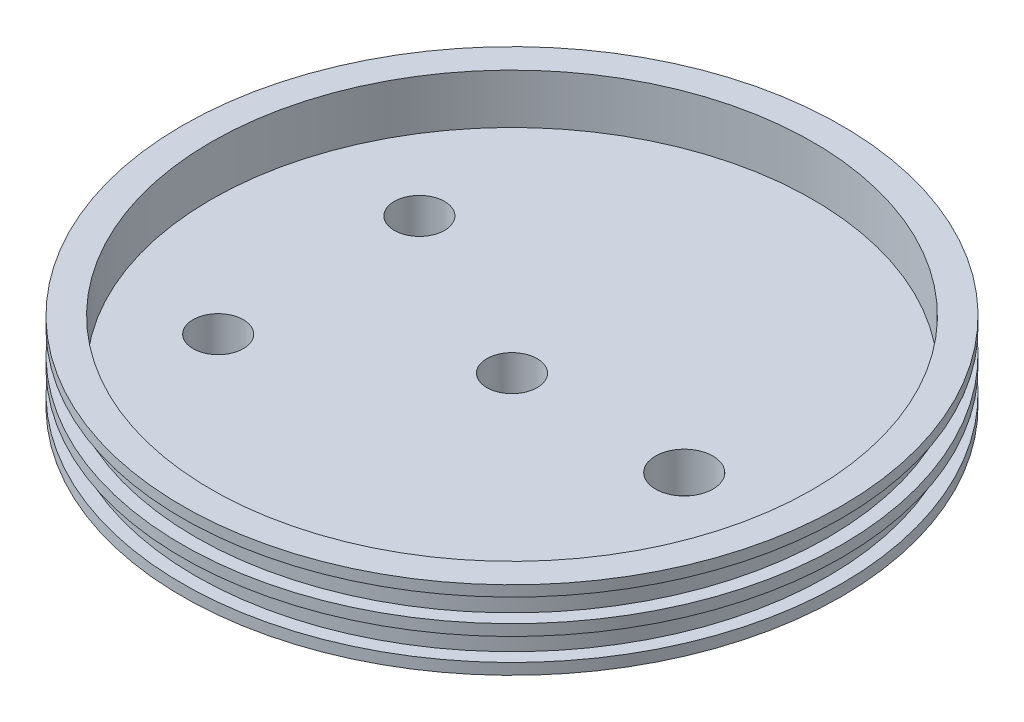
from build123d import *

# Parameters (mm, degrees)
SKETCH6_R                                = 66.04
BOSS_EXTRUDE1_DEPTH                      = 2.54
PIPE_TAP_DRILL_FOR_1_4_TAP_GN2_D         = 11.1252
SKETCH7_R                                = 6.35
CUT_EXTRUDE1_SIPHON_DEPTH                = 105.994177492
PIPE_TAP_DRILL_FOR_1_4_TAP_RELIEF_VALV_D = 11.1252
PIPE_TAP_DRILL_FOR_1_4_TAP_VENT_VALVE_D  = 11.1252


with BuildPart() as part:
    # Sketch1 → Revolve1 (revolve)
    with BuildSketch(Plane.XY, mode=Mode.PRIVATE) as revolve1_sk:
        Polygon((0, 0), (72.898, 0), (72.898, 2.4638), (69.977, 2.4638), (69.977, 7.4422), (72.898, 7.4422), (72.898, 9.906), (69.977, 9.906), (69.977, 14.986), (72.898, 14.986), (72.898, 17.3482), (66.548, 17.3482), (66.548, 6.35), (0, 6.35), align=None)
    revolve(revolve1_sk.sketch.rotate(Axis((0, 48.192213231, 0), (0, -1, 0)), 180), axis=Axis((0, 48.192213231, 0), (0, -1, 0)))

    # Sketch6 → Boss-Extrude1 (add)
    with BuildSketch(Plane.XZ):
        Circle(SKETCH6_R)
    extrude(amount=BOSS_EXTRUDE1_DEPTH)

    # Pipe Tap Drill for 1/4 Tap - GN2 (through all)
    with Locations(Plane(origin=(0, 6.35, 0), x_dir=(1, 0, 0), z_dir=(0, 1, 0))):
        with Locations((0, 0)):
            Hole(PIPE_TAP_DRILL_FOR_1_4_TAP_GN2_D / 2)

    # Sketch7 → Cut-Extrude1-Siphon (cut, through all)
    with BuildSketch(Plane(origin=(0, -2.54, 0), x_dir=(-1, 0, 0), z_dir=(0, -1, 0))):
        with Locations(Location((-38.1, 0, 0), (0, 0, 180))):
            Circle(SKETCH7_R)
    extrude(amount=-CUT_EXTRUDE1_SIPHON_DEPTH, mode=Mode.SUBTRACT)

    # Pipe Tap Drill for 1/4 Tap - Relief Valve (through all)
    with Locations(Plane(origin=(0, -2.54, 0), x_dir=(-1, 0, 0), z_dir=(0, -1, 0))):
        with Locations((40.358041229, 19.878625199)):
            Hole(PIPE_TAP_DRILL_FOR_1_4_TAP_RELIEF_VALV_D / 2)

    # Pipe Tap Drill for 1/4 Tap - Vent Valve (through all)
    with Locations(Plane(origin=(0, -2.54, 0), x_dir=(-1, 0, 0), z_dir=(0, -1, 0))):
        with Locations((39.961427255, -25.031151171)):
            Hole(PIPE_TAP_DRILL_FOR_1_4_TAP_VENT_VALVE_D / 2)


solid = part.part
